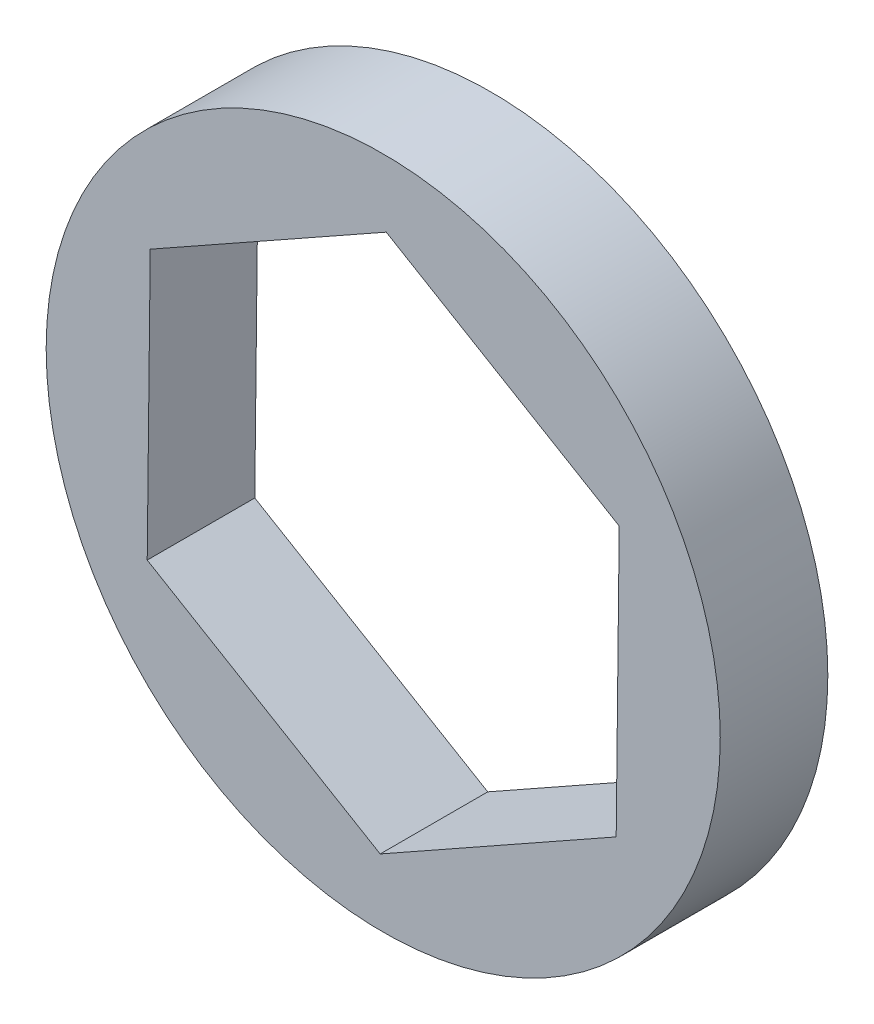
from build123d import *

# Parameters (mm, degrees)
CROQUIS1_R              = 9.4
SALIENTE_EXTRUIR2_DEPTH = 3


with BuildPart() as part:
    # Croquis1 → Saliente-Extruir2 (new body)
    with BuildSketch(Plane.XY):
        Circle(CROQUIS1_R)
        Polygon((6.497272807, -3.848927913), (6.581905753, 3.70233935), (0.084632946, 7.551267262), (-6.497272807, 3.848927913), (-6.581905753, -3.70233935), (-0.084632946, -7.551267262), align=None, mode=Mode.SUBTRACT)
    extrude(amount=SALIENTE_EXTRUIR2_DEPTH)


solid = part.part
